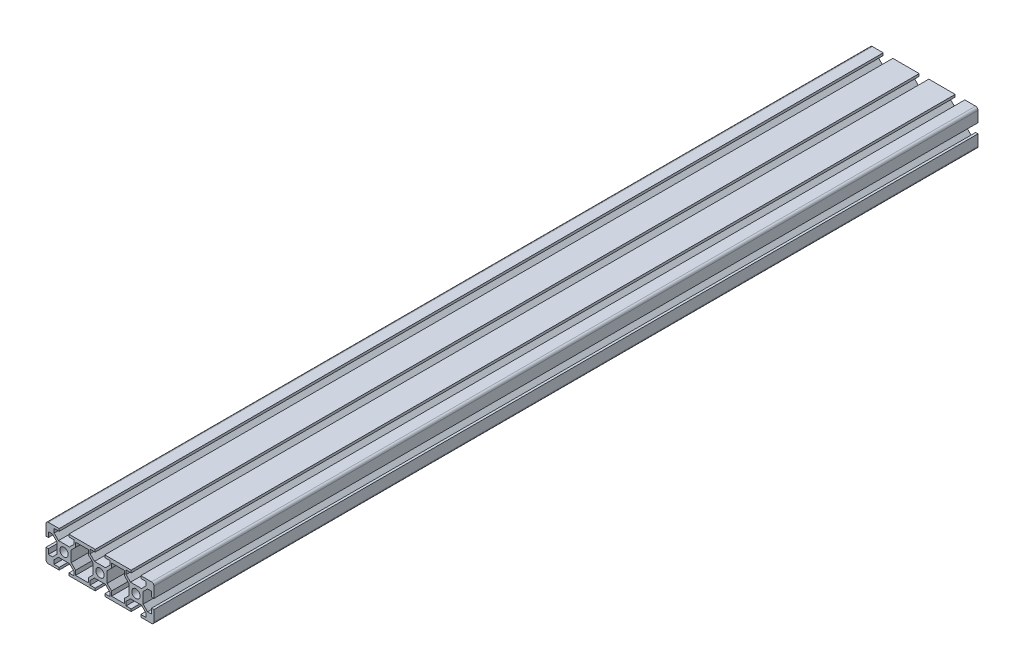
from build123d import *

# Parameters (mm, degrees)
SKETCH1_W                      = 90
SKETCH1_H                      = 30
BOSS_EXTRUDE1_DEPTH            = 343.5
M8X1_0_TAPPED_HOLE1_AT_2_COUNT = 2
M8X1_0_TAPPED_HOLE1_AT_2_PITCH = 60
M8X1_0_TAPPED_HOLE1_AT_3_COUNT = 2
M8X1_0_TAPPED_HOLE1_AT_3_PITCH = 30
CUT_EXTRUDE1_DEPTH             = 690.125532831
FILLET1_R                      = 2


with BuildPart() as part:
    # Sketch1 → Boss-Extrude1 (new, symmetric)
    with BuildSketch(Plane.XY):
        with Locations((0, 15)):
            Rectangle(SKETCH1_W, SKETCH1_H)
    extrude(amount=BOSS_EXTRUDE1_DEPTH, both=True)

    # Sketch3 → M8x1.0 Tapped Hole1 (revolve, cut)
    with BuildSketch(Plane(origin=(30, 15, 343.5), x_dir=(0, -1, 0), z_dir=(1, 0, 0))):
        Polygon((0, 0), (0, 21.103012167), (3.5, 19), (3.5, 0), align=None)
    m8x1_0_tapped_hole1 = revolve(axis=Axis((30, 15, 349.85), (0, 0, -1)), mode=Mode.SUBTRACT)

    # M8x1.0 Tapped Hole1 at 2: M8x1.0 Tapped Hole1 ×2
    with Locations(*[(-i * M8X1_0_TAPPED_HOLE1_AT_2_PITCH, 0, 0) for i in range(1, M8X1_0_TAPPED_HOLE1_AT_2_COUNT)]):
        add(m8x1_0_tapped_hole1, mode=Mode.SUBTRACT)

    # M8x1.0 Tapped Hole1 at 3: M8x1.0 Tapped Hole1 ×2
    with Locations(*[(-i * M8X1_0_TAPPED_HOLE1_AT_3_PITCH, 0, 0) for i in range(1, M8X1_0_TAPPED_HOLE1_AT_3_COUNT)]):
        add(m8x1_0_tapped_hole1, mode=Mode.SUBTRACT)

    # Mirror1: M8x1.0 Tapped Hole1 across plane
    add(m8x1_0_tapped_hole1.mirror(Plane.XY), mode=Mode.SUBTRACT)

    # Mirror1 copy 1 sketch → Mirror1 copy 1 (revolve, cut)
    with BuildSketch(Plane(origin=(-30, 15, -343.5), x_dir=(0, -1, 0), z_dir=(1, 0, 0))):
        Polygon((0, 0), (0, -21.103012167), (3.5, -19), (3.5, 0), align=None)
    revolve(axis=Axis((-30, 15, -349.85), (0, 0, -1)), mode=Mode.SUBTRACT)

    # Mirror1 copy 2 sketch → Mirror1 copy 2 (revolve, cut)
    with BuildSketch(Plane(origin=(0, 15, -343.5), x_dir=(0, -1, 0), z_dir=(1, 0, 0))):
        Polygon((0, 0), (0, -21.103012167), (3.5, -19), (3.5, 0), align=None)
    revolve(axis=Axis((0, 15, -349.85), (0, 0, -1)), mode=Mode.SUBTRACT)

    # Sketch4 → Cut-Extrude1 (cut, through all)
    with BuildSketch(Plane.XY.offset(343.5)):
        Polygon((-4, 2), (-4, 0), (0, 0), (0, 9), (-4.585786438, 9), (-8.25, 5.335786438), (-8.25, 2), align=None)
        Polygon((0, 30), (-4, 30), (-4, 28), (-8.25, 28), (-8.25, 24.664213562), (-4.585786438, 21), (0, 21), align=None)
        Polygon((-34, 2), (-34, 0), (-30, 0), (-26, 0), (-26, 2), (-21.75, 2), (-21.75, 5.335786438), (-25.414213562, 9), (-34.585786438, 9), (-38.25, 5.335786438), (-38.25, 2), align=None)
        Polygon((-20.335786438, 3), (-9.664213562, 3), (-9.664213562, 6.75), (-6, 10.414213562), (-6, 19.585786438), (-9.664213562, 23.25), (-9.664213562, 27), (-20.335786438, 27), (-20.335786438, 23.25), (-24, 19.585786438), (-24, 10.414213562), (-20.335786438, 6.75), align=None)
        Polygon((-30, 30), (-34, 30), (-34, 28), (-38.25, 28), (-38.25, 24.664213562), (-34.585786438, 21), (-25.414213562, 21), (-21.75, 24.664213562), (-21.75, 28), (-26, 28), (-26, 30), align=None)
        Polygon((-43, 19), (-45, 19), (-45, 15), (-45, 11), (-43, 11), (-43, 6.75), (-39.664213562, 6.75), (-36, 10.414213562), (-36, 19.585786438), (-39.664213562, 23.25), (-43, 23.25), align=None)
    cut_extrude1 = extrude(amount=-CUT_EXTRUDE1_DEPTH, mode=Mode.SUBTRACT)

    # Mirror2: Cut-Extrude1 across plane
    add(cut_extrude1.mirror(Plane(origin=(0, 0, 0), x_dir=(0, 0, 1), z_dir=(1, 0, 0))), mode=Mode.SUBTRACT)

    # Fillet1
    fillet1_edges = [part.edges().sort_by_distance(p)[0] for p in [
        (-45, 30, 0),
        (45, 30, 0),
        (45, 0, 0),
        (-45, 0, 0),
    ]]
    fillet(fillet1_edges, radius=FILLET1_R)


solid = part.part
